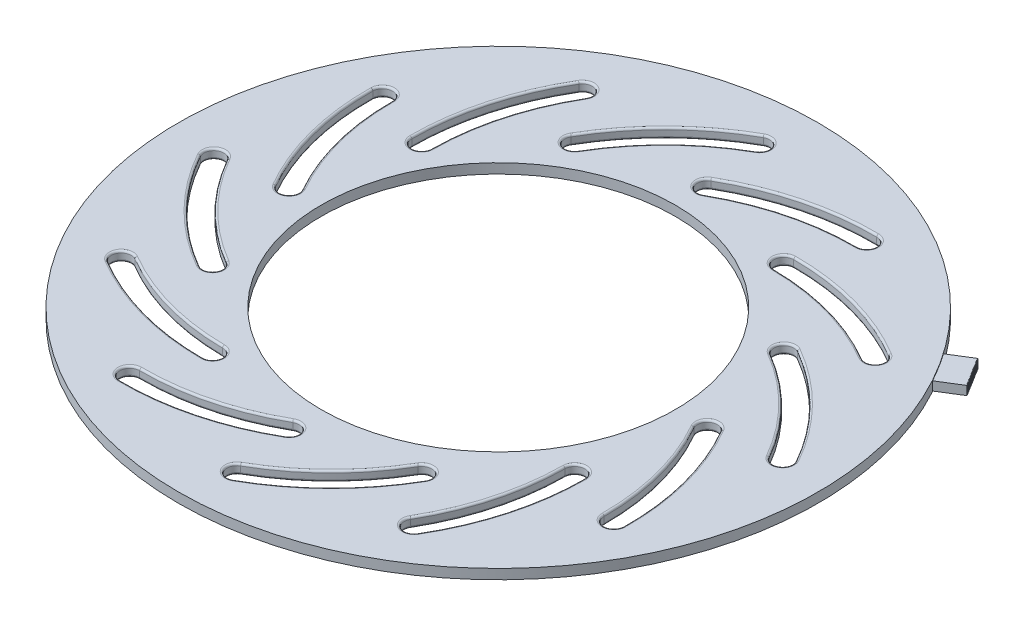
from build123d import *

# Parameters (mm, degrees)
SKETCH_01_R                          = 65
SKETCH_01_R_2                        = 36
TOP_RING_DEPTH                       = 2
CUT_EXTRUDE1_DEPTH                   = 92.945636112
FILLET1_R                            = 0.4
CIRPATTERN1_COUNT                    = 12
FILLET1_OF_CIRPATTERN1_R             = 0.4
SKETCH5_W                            = 6.903653501
SKETCH5_H                            = 1.8
BOSS_EXTRUDE4_DEPTH                  = 5
BOSS_EXTRUDE4_DIRECTION_2_REACH      = 157.932
BOSS_EXTRUDE4_DIRECTION_2_END_RADIUS = 65
SKETCH6_W                            = 0.088237506
SKETCH6_H                            = 1.8
CUT_EXTRUDE2_DEPTH                   = 0.1
LPATTERN1_COUNT                      = 5
LPATTERN1_PITCH                      = 0.2
LPATTERN1_COL_COUNT                  = 31
LPATTERN1_COL_PITCH                  = 0.2


with BuildPart() as part:
    # sketch 01 → top ring (new body)
    with BuildSketch(Plane(origin=(0, 0, 0), x_dir=(1, 0, 0), z_dir=(0, 1, 0))):
        with Locations(Location((0, 0, 0), (0, 0, 270))):
            Circle(SKETCH_01_R)
        with Locations(Location((0, 0, 0), (0, 0, 270))):
            Circle(SKETCH_01_R_2, mode=Mode.SUBTRACT)
    extrude(amount=TOP_RING_DEPTH)

    # Sketch2 → Cut-Extrude1 (cut, through all)
    with BuildSketch(Plane(origin=(0, 2, 0), x_dir=(1, 0, 0), z_dir=(0, 1, 0))):
        with BuildLine():
            ThreePointArc((-1, 44.232050808), (11.890599802, 49.519139452), (25.722326885, 51.193712683))
            ThreePointArc((25.722326885, 51.193712683), (27.694418732, 49.171424871), (25.677365486, 47.193979435))
            ThreePointArc((25.677365486, 47.193979435), (12.908045968, 45.613674132), (0.990803619, 40.762672112))
            ThreePointArc((0.990803619, 40.762672112), (-1.734695442, 41.504594694), (-1, 44.232050808))
        make_face()
    cut_extrude1 = extrude(amount=-CUT_EXTRUDE1_DEPTH, mode=Mode.SUBTRACT)

    # Fillet1
    fillet1_edges = [part.edges().sort_by_distance(p)[0] for p in [
        (-1.734695442, 0, -41.504594694),
        (11.890599802, 2, -49.519139452),
        (27.694418732, 2, -49.171424871),
        (12.908045968, 0, -45.613674132),
        (11.890599802, 0, -49.519139452),
        (27.694418732, 0, -49.171424871),
        (-1.734695442, 2, -41.504594694),
        (12.908045968, 2, -45.613674132),
    ]]
    fillet(fillet1_edges, radius=FILLET1_R)

    # CirPattern1: Cut-Extrude1 ×12 about axis
    cirpattern1_axis = Axis((0, 0, 0), (0, 1, 0))
    for i in range(1, CIRPATTERN1_COUNT):
        add(cut_extrude1.rotate(cirpattern1_axis, i * 360 / CIRPATTERN1_COUNT), mode=Mode.SUBTRACT)

    # Fillet1 of CirPattern1
    fillet1_of_cirpattern1_edges = [part.edges().sort_by_distance(p)[0] for p in [
        (-22.254587667, 0, -35.076685658),
        (-14.462008231, 2, -48.83013264),
        (-0.601642271, 2, -56.430912444),
        (-11.628141345, 0, -45.956623542),
        (-14.462008231, 0, -48.83013264),
        (-0.601642271, 0, -56.430912444),
        (-22.254587667, 2, -35.076685658),
        (-11.628141345, 2, -45.956623542),
        (-36.811381099, 0, -19.250007026),
        (-36.939532838, 2, -35.057131221),
        (-28.736493713, 2, -48.5697826),
        (-33.048577574, 0, -33.985532787),
        (-36.939532838, 0, -35.057131221),
        (-28.736493713, 0, -48.5697826),
        (-36.811381099, 2, -19.250007026),
        (-33.048577574, 2, -33.985532787),
        (-41.504594694, 0, 1.734695442),
        (-49.519139452, 2, -11.890599802),
        (-49.171424871, 2, -27.694418732),
        (-45.613674132, 0, -12.908045968),
        (-49.519139452, 0, -11.890599802),
        (-49.171424871, 0, -27.694418732),
        (-41.504594694, 2, 1.734695442),
        (-45.613674132, 2, -12.908045968),
        (-35.076685658, 0, 22.254587667),
        (-48.83013264, 2, 14.462008231),
        (-56.430912444, 2, 0.601642271),
        (-45.956623542, 0, 11.628141345),
        (-48.83013264, 0, 14.462008231),
        (-56.430912444, 0, 0.601642271),
        (-35.076685658, 2, 22.254587667),
        (-45.956623542, 2, 11.628141345),
        (-19.250007026, 0, 36.811381099),
        (-35.057131221, 2, 36.939532838),
        (-48.5697826, 2, 28.736493713),
        (-33.985532787, 0, 33.048577574),
        (-35.057131221, 0, 36.939532838),
        (-48.5697826, 0, 28.736493713),
        (-19.250007026, 2, 36.811381099),
        (-33.985532787, 2, 33.048577574),
        (1.734695442, 0, 41.504594694),
        (-11.890599802, 2, 49.519139452),
        (-27.694418732, 2, 49.171424871),
        (-12.908045968, 0, 45.613674132),
        (-11.890599802, 0, 49.519139452),
        (-27.694418732, 0, 49.171424871),
        (1.734695442, 2, 41.504594694),
        (-12.908045968, 2, 45.613674132),
        (22.254587667, 0, 35.076685658),
        (14.462008231, 2, 48.83013264),
        (0.601642271, 2, 56.430912444),
        (11.628141345, 0, 45.956623542),
        (14.462008231, 0, 48.83013264),
        (0.601642271, 0, 56.430912444),
        (22.254587667, 2, 35.076685658),
        (11.628141345, 2, 45.956623542),
        (36.811381099, 0, 19.250007026),
        (36.939532838, 2, 35.057131221),
        (28.736493713, 2, 48.5697826),
        (33.048577574, 0, 33.985532787),
        (36.939532838, 0, 35.057131221),
        (28.736493713, 0, 48.5697826),
        (36.811381099, 2, 19.250007026),
        (33.048577574, 2, 33.985532787),
        (41.504594694, 0, -1.734695442),
        (49.519139452, 2, 11.890599802),
        (49.171424871, 2, 27.694418732),
        (45.613674132, 0, 12.908045968),
        (49.519139452, 0, 11.890599802),
        (49.171424871, 0, 27.694418732),
        (41.504594694, 2, -1.734695442),
        (45.613674132, 2, 12.908045968),
        (35.076685658, 0, -22.254587667),
        (48.83013264, 2, -14.462008231),
        (56.430912444, 2, -0.601642271),
        (45.956623542, 0, -11.628141345),
        (48.83013264, 0, -14.462008231),
        (56.430912444, 0, -0.601642271),
        (35.076685658, 2, -22.254587667),
        (45.956623542, 2, -11.628141345),
        (19.250007026, 0, -36.811381099),
        (35.057131221, 2, -36.939532838),
        (48.5697826, 2, -28.736493713),
        (33.985532787, 0, -33.048577574),
        (35.057131221, 0, -36.939532838),
        (48.5697826, 0, -28.736493713),
        (19.250007026, 2, -36.811381099),
        (33.985532787, 2, -33.048577574),
    ]]
    fillet(fillet1_of_cirpattern1_edges, radius=FILLET1_OF_CIRPATTERN1_R)

    # Sketch5 → Boss-Extrude4 (add)
    with BuildSketch(Plane(origin=(55.224694191, 0, -34.281673698), x_dir=(-0.5274103645771829, 0, -0.8496106798625845), z_dir=(0.8496106798625844, 0, -0.5274103645771828))):
        with Locations((-0.000183771, 1)):
            Rectangle(SKETCH5_W, SKETCH5_H)
    extrude(amount=BOSS_EXTRUDE4_DEPTH)

    # Boss-Extrude4 direction 2: up to this cylinder (the profile starts outside it)
    boss_extrude4_direction_2_end = Plane(origin=(0, 1, 0), z_dir=(0, -1, 0)) * Cylinder(BOSS_EXTRUDE4_DIRECTION_2_END_RADIUS, 446.864, mode=Mode.PRIVATE)
    # Sketch5 → Boss-Extrude4 direction 2 (add, up to the surface)
    with BuildSketch(Plane(origin=(55.224694191, 0, -34.281673698), x_dir=(-0.5274103645771829, 0, -0.8496106798625845), z_dir=(0.8496106798625844, 0, -0.5274103645771828)), mode=Mode.PRIVATE) as boss_extrude4_direction_2_sk1:
        with Locations((-0.000183771, 1)):
            Rectangle(SKETCH5_W, SKETCH5_H)
    boss_extrude4_direction_2_tool1 = extrude(boss_extrude4_direction_2_sk1.sketch, amount=-BOSS_EXTRUDE4_DIRECTION_2_REACH, mode=Mode.PRIVATE) - boss_extrude4_direction_2_end
    add(boss_extrude4_direction_2_tool1.solids().sort_by_distance((55.224791, 1, -34.281518))[0])
    add(boss_extrude4_direction_2_tool1.solids().sort_by_distance((55.224791, 1, -34.281518))[1])

    # Sketch6 → Cut-Extrude2 (cut)
    with BuildSketch(Plane(origin=(59.47274759, 0, -36.91872552), x_dir=(-0.5274103645771832, 0, -0.8496106798625844), z_dir=(0.8496106798625843, 0, -0.527410364577183))):
        with Locations((-2.642433807, 1)):
            Rectangle(SKETCH6_W, SKETCH6_H)
    cut_extrude2 = extrude(amount=-CUT_EXTRUDE2_DEPTH, mode=Mode.SUBTRACT)

    # LPattern1: Cut-Extrude2 ×5
    with Locations(*[Vector(0.5274103645771823, 0, 0.849610679862585) * (i * LPATTERN1_PITCH) for i in range(1, LPATTERN1_COUNT)]):
        add(cut_extrude2, mode=Mode.SUBTRACT)

    # LPattern1 col: Cut-Extrude2 ×31
    with Locations(*[Vector(-0.5274103645771823, 0, -0.849610679862585) * (i * LPATTERN1_COL_PITCH) for i in range(1, LPATTERN1_COL_COUNT)]):
        add(cut_extrude2, mode=Mode.SUBTRACT)


solid = part.part
